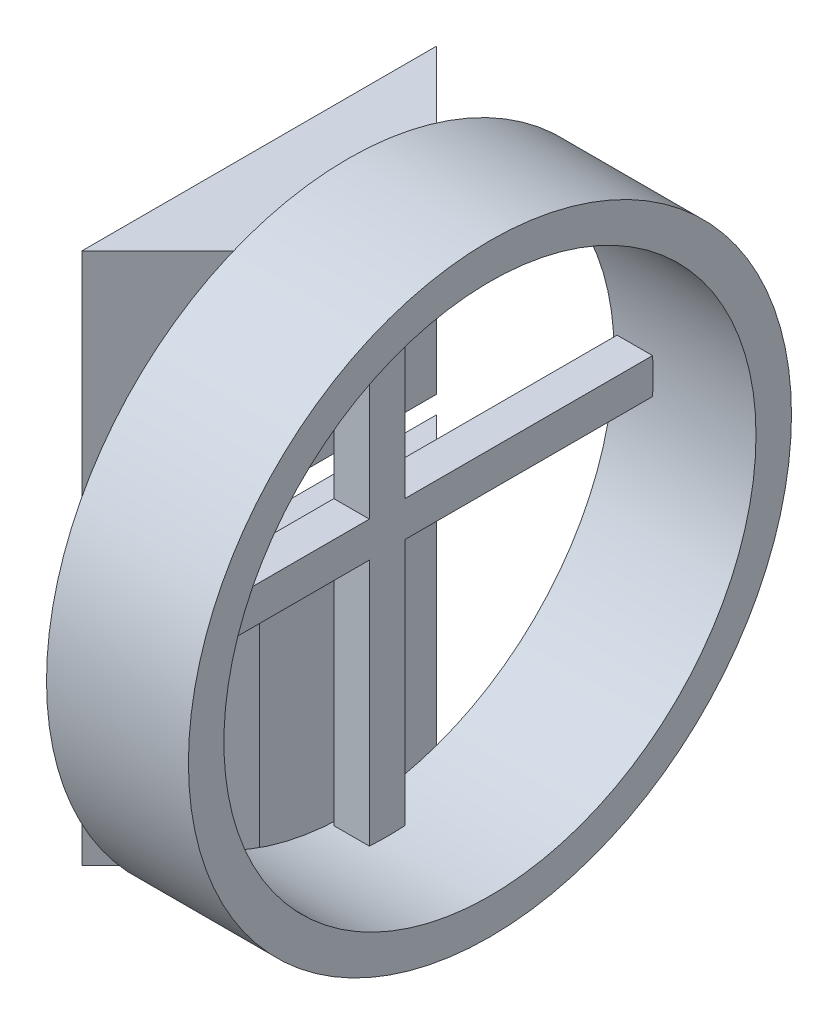
from build123d import *

# Parameters (mm, degrees)
BOSS_EXTRUDE1_DEPTH     = 15
SKETCH4_R               = 8.5
SKETCH4_R_2             = 7.5
EXTRUDE_THIN1_DEPTH     = 4
EXTRUDE_THIN5_START     = 0.1
EXTRUDE_THIN5_DEPTH     = 1
CIRPATTERN2_COUNT       = 4
CUT_EXTRUDE2_DEPTH      = 25.50510151
CUT_EXTRUDE2_DEPTH_BACK = 25.50510151
SKETCH9_W               = 5
SKETCH9_H               = 3


with BuildPart() as part:
    # Sketch3 → Boss-Extrude1 (new body)
    with BuildSketch(Plane(origin=(0, 0, 0), x_dir=(1, 0, 0), z_dir=(0, 1, 0))):
        Polygon((10, 5), (10, -5), (12.5, -2.5), (12.5, 2.5), align=None)
    extrude(amount=BOSS_EXTRUDE1_DEPTH)

    # Sketch9 → Cut-Extrude2 (cut, two sides: drawn at the far end of the back side and taken through both)
    with BuildSketch(Plane.XY.offset(-CUT_EXTRUDE2_DEPTH_BACK)):
        with Locations((10, 7.5)):
            Rectangle(SKETCH9_W, SKETCH9_H)
    extrude(amount=CUT_EXTRUDE2_DEPTH + CUT_EXTRUDE2_DEPTH_BACK, mode=Mode.SUBTRACT)


with BuildPart() as body_2:
    # Sketch4 → Extrude-Thin1 (new body)
    with BuildSketch(Plane(origin=(12.5, 0, 0), x_dir=(0, 0, -1), z_dir=(1, 0, 0))):
        with Locations((0, 7.5)):
            Circle(SKETCH4_R)
        with Locations((0, 7.5)):
            Circle(SKETCH4_R_2, mode=Mode.SUBTRACT)
    extrude(amount=EXTRUDE_THIN1_DEPTH)

    # Sketch7 → Extrude-Thin5 (add)
    with BuildSketch(Plane(origin=(12.5, 0, 0), x_dir=(0, 0, -1), z_dir=(1, 0, 0)).offset(EXTRUDE_THIN5_START)):
        Polygon((-8.036394857, 7), (0, 7), (8.036394857, 7), (8.036394857, 8), (0, 8), (-8.036394857, 8), align=None)
    extrude_thin5 = extrude(amount=EXTRUDE_THIN5_DEPTH)

    # CirPattern2: Extrude-Thin5 ×4 about axis
    cirpattern2_axis = Axis((16.5, 7.5, 0), (1, 0, 0))
    for i in range(1, CIRPATTERN2_COUNT):
        add(extrude_thin5.rotate(cirpattern2_axis, i * 360 / CIRPATTERN2_COUNT))


with BuildPart() as cut_extrude2_piece_1:
    # of the separate pieces the step leaves, piece 1, a body of its own (cut_extrude2_pieces)
    add(part.part.solids().sort_by_distance((10, 0, -5))[0])


with BuildPart() as cut_extrude2_piece_2:
    # of the separate pieces the step leaves, piece 2, a body of its own (cut_extrude2_pieces)
    add(part.part.solids().sort_by_distance((10, 9, -5))[0])


solid = Compound([body_2.part, cut_extrude2_piece_1.part, cut_extrude2_piece_2.part])
